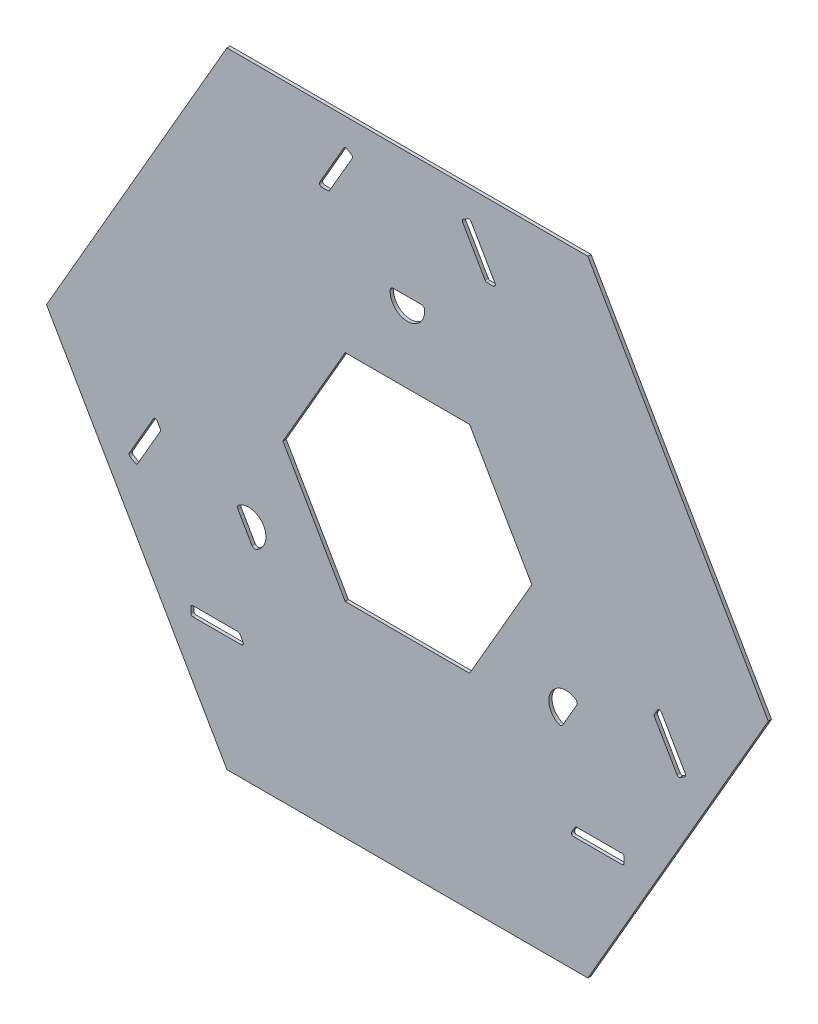
from build123d import *

# Parameters (mm, degrees)
BOSS_EXTRUDE1_DEPTH = 3
CUT_EXTRUDE1_DEPTH  = 443.992475482
CIRPATTERN1_COUNT   = 3
CUT_EXTRUDE2_DEPTH  = 443.992475482


with BuildPart() as part:
    # Sketch1 → Boss-Extrude1 (new body)
    with BuildSketch(Plane.XY):
        Polygon((334.86315613, 0), (167.431578065, 290), (-167.431578065, 290), (-334.86315613, 0), (-167.431578065, -290), (167.431578065, -290), align=None)
        Polygon((57.735026919, 100), (-57.735026919, 100), (-115.470053838, 0), (-57.735026919, -100), (57.735026919, -100), (115.470053838, 0), align=None, mode=Mode.SUBTRACT)
    extrude(amount=BOSS_EXTRUDE1_DEPTH)

    # Sketch2 → Cut-Extrude1 (cut, through all)
    with BuildSketch(Plane(origin=(0, 0, 0), x_dir=(-1, 0, 0), z_dir=(0, 0, -1))):
        with BuildLine():
            Line((-51.188420258, 259.339055353), (-72.112031884, 223.098296941))
            ThreePointArc((-72.112031884, 223.098296941), (-72.844082691, 222.366246133), (-73.844082691, 222.098296941))
            Line((-73.844082691, 222.098296941), (-79.617585383, 222.098296941))
            ThreePointArc((-79.617585383, 222.098296941), (-81.349636191, 223.098296941), (-81.349636191, 225.098296941))
            Line((-81.349636191, 225.098296941), (-58.982648893, 263.839055353))
            ThreePointArc((-58.982648893, 263.839055353), (-57.768236175, 264.770907006), (-56.250598085, 264.571106161))
            Line((-56.250598085, 264.571106161), (-51.920471066, 262.071106161))
            ThreePointArc((-51.920471066, 262.071106161), (-50.988619413, 260.856693443), (-51.188420258, 259.339055353))
        make_face()
        with BuildLine():
            Line((56.250598085, 264.571106161), (51.920471066, 262.071106161))
            ThreePointArc((51.920471066, 262.071106161), (50.988619413, 260.856693443), (51.188420258, 259.339055353))
            Line((51.188420258, 259.339055353), (72.112031884, 223.098296941))
            ThreePointArc((72.112031884, 223.098296941), (72.844082691, 222.366246133), (73.844082691, 222.098296941))
            Line((73.844082691, 222.098296941), (79.617585383, 222.098296941))
            ThreePointArc((79.617585383, 222.098296941), (81.349636191, 223.098296941), (81.349636191, 225.098296941))
            Line((81.349636191, 225.098296941), (58.982648893, 263.839055353))
            ThreePointArc((58.982648893, 263.839055353), (57.768236175, 264.770907006), (56.250598085, 264.571106161))
        make_face()
    cut_extrude1 = extrude(amount=-CUT_EXTRUDE1_DEPTH, mode=Mode.SUBTRACT)

    # CirPattern1: Cut-Extrude1 ×3 about axis
    cirpattern1_axis = Axis((0, 0, -0.2), (0, 0, 1))
    for i in range(1, CIRPATTERN1_COUNT):
        add(cut_extrude1.rotate(cirpattern1_axis, i * 360 / CIRPATTERN1_COUNT), mode=Mode.SUBTRACT)

    # Sketch3 → Cut-Extrude2 (cut, through all)
    with BuildSketch(Plane.XY.offset(3)):
        with BuildLine():
            Line((-12.961481397, 174), (12.961481397, 174))
            ThreePointArc((12.961481397, 174), (14.999580058, 173.201398157), (15.952592488, 171.230769231))
            ThreePointArc((15.952592488, 171.230769231), (0, 154), (-15.952592488, 171.230769231))
            ThreePointArc((-15.952592488, 171.230769231), (-14.999580058, 173.201398157), (-12.961481397, 174))
        make_face()
        with BuildLine():
            Line((-157.169160957, -75.77502784), (-144.20767956, -98.22497216))
            ThreePointArc((-144.20767956, -98.22497216), (-142.497020746, -99.590716455), (-140.313899819, -99.430734967))
            ThreePointArc((-140.313899819, -99.430734967), (-133.367912183, -77), (-156.266492308, -71.800034264))
            ThreePointArc((-156.266492308, -71.800034264), (-157.496600804, -73.610681702), (-157.169160957, -75.77502784))
        make_face()
        with BuildLine():
            Line((157.169160957, -75.77502784), (144.20767956, -98.22497216))
            ThreePointArc((144.20767956, -98.22497216), (142.497020746, -99.590716455), (140.313899819, -99.430734967))
            ThreePointArc((140.313899819, -99.430734967), (133.367912183, -77), (156.266492308, -71.800034264))
            ThreePointArc((156.266492308, -71.800034264), (157.496600804, -73.610681702), (157.169160957, -75.77502784))
        make_face()
    extrude(amount=-CUT_EXTRUDE2_DEPTH, mode=Mode.SUBTRACT)


solid = part.part
